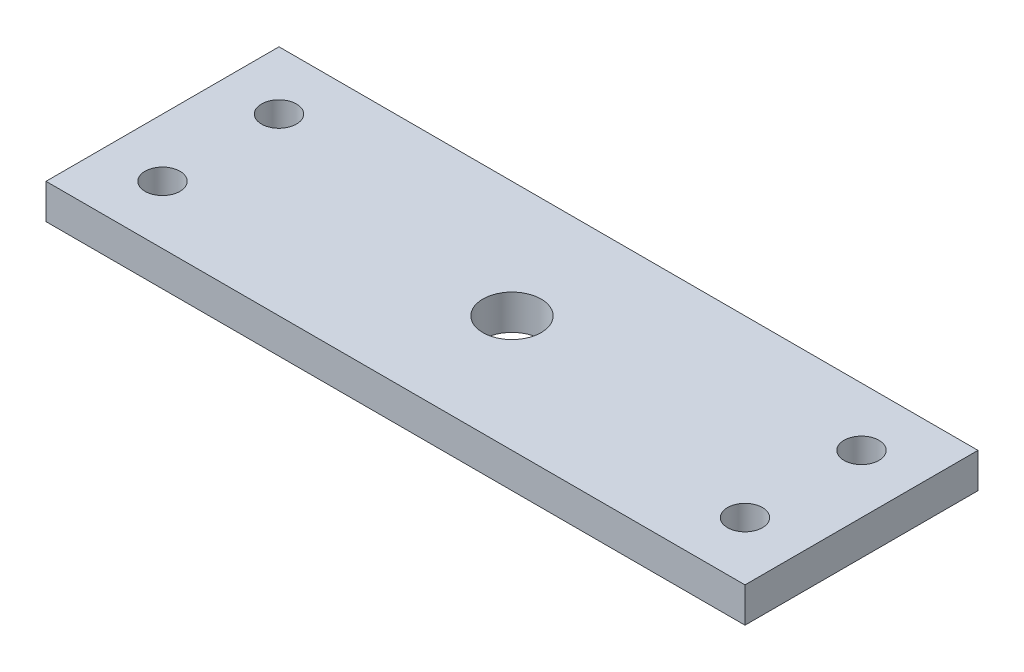
from build123d import *

# Parameters (mm, degrees)
SKETCH1_W           = 60
SKETCH1_H           = 20
SKETCH1_R           = 2.5
SKETCH1_R_2         = 1.5
BOSS_EXTRUDE1_DEPTH = 3


with BuildPart() as part:
    # Sketch1 → Boss-Extrude1 (new body)
    with BuildSketch(Plane(origin=(0, 0, 0), x_dir=(1, 0, 0), z_dir=(0, 1, 0))):
        with Locations((-30, 10)):
            Rectangle(SKETCH1_W, SKETCH1_H)
        with Locations(Location((-30, 10, 0), (0, 0, 270))):
            Circle(SKETCH1_R, mode=Mode.SUBTRACT)
        with Locations(Location((-55, 15, 0), (0, 0, 270))):
            Circle(SKETCH1_R_2, mode=Mode.SUBTRACT)
        with Locations(Location((-55, 5, 0), (0, 0, 90))):
            Circle(SKETCH1_R_2, mode=Mode.SUBTRACT)
        with Locations(Location((-5, 15, 0), (0, 0, 90))):
            Circle(SKETCH1_R_2, mode=Mode.SUBTRACT)
        with Locations(Location((-5, 5, 0), (0, 0, 270))):
            Circle(SKETCH1_R_2, mode=Mode.SUBTRACT)
    extrude(amount=BOSS_EXTRUDE1_DEPTH)


solid = part.part
